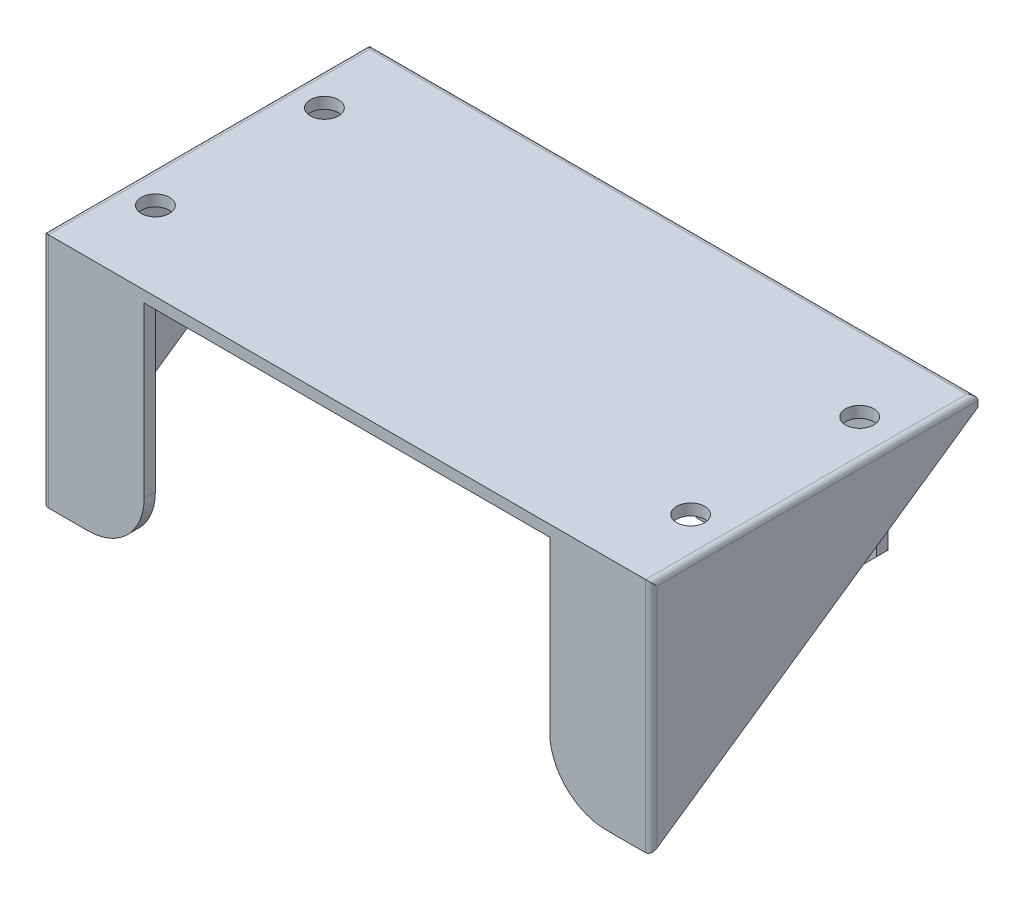
from build123d import *

# Parameters (mm, degrees)
SKETCH_1_W         = 54
SKETCH_1_H         = 29
EXTRUDE_1_DEPTH    = 1
EXTRUDE_2_DEPTH    = 1
EXTRUDE_3_DEPTH    = 1
SKETCH_4_W         = 1
SKETCH_4_H         = 20
EXTRUDE_4_DEPTH    = 8
SKETCH_5_W         = 1
SKETCH_5_H         = 20
EXTRUDE_5_DEPTH    = 8
SKETCH_6_W         = 21
SKETCH_6_H         = 1
EXTRUDE_6_DEPTH    = 20
HOLE_WIZARD_M3_1_D = 2.5
CHAMFER_1_SIZE     = 5
FILLET_1_R         = 0.5
FILLET_2_R         = 5
HOLE_WIZARD_M3_2_D = 2.5


with BuildPart() as part:
    # 草图1 → 凸台-拉伸1 (new body)
    with BuildSketch(Plane(origin=(0, 0, 0), x_dir=(1, 0, 0), z_dir=(0, 1, 0))):
        with Locations((-27, 14.5)):
            Rectangle(SKETCH_1_W, SKETCH_1_H)
    extrude(amount=EXTRUDE_1_DEPTH)

    # 草图2 → 凸台-拉伸2 (add)
    with BuildSketch(Plane.ZY.offset(54)):
        Polygon((-29, 0), (0, 0), (0, -20), align=None)
    extrude(amount=-EXTRUDE_2_DEPTH)

    # 草图3 → 凸台-拉伸3 (add)
    with BuildSketch(Plane(origin=(0, 0, 0), x_dir=(0, 0, -1), z_dir=(1, 0, 0))):
        Polygon((0, 0), (0, -20), (29, 0), align=None)
    extrude(amount=-EXTRUDE_3_DEPTH)

    # 草图4 → 凸台-拉伸4 (add)
    with BuildSketch(Plane.ZY.offset(1)):
        with Locations((-0.5, -10)):
            Rectangle(SKETCH_4_W, SKETCH_4_H)
    extrude(amount=EXTRUDE_4_DEPTH)

    # 草图5 → 凸台-拉伸5 (add)
    with BuildSketch(Plane(origin=(-53, 0, 0), x_dir=(0, 0, -1), z_dir=(1, 0, 0))):
        with Locations((0.5, -10)):
            Rectangle(SKETCH_5_W, SKETCH_5_H)
    extrude(amount=EXTRUDE_5_DEPTH)

    # 草图6 → 凸台-拉伸6 (add)
    with BuildSketch(Plane.XZ):
        with Locations((-18.5, -28.5)):
            Rectangle(SKETCH_6_W, SKETCH_6_H)
    extrude(amount=EXTRUDE_6_DEPTH)

    # M3 螺纹孔1 (through all)
    with Locations(Plane(origin=(0, 0, -29), x_dir=(-1, 0, 0), z_dir=(0, 0, -1))):
        with Locations((18, -10)):
            Hole(HOLE_WIZARD_M3_1_D / 2)

    # 倒角1
    chamfer_1_edges = [part.edges().sort_by_distance(p)[0] for p in [
        (-8, -20, -28.5),
        (-29, -20, -28.5),
    ]]
    chamfer(chamfer_1_edges, length=CHAMFER_1_SIZE)

    # 圆角1
    fillet_1_edges = [part.edges().sort_by_distance(p)[0] for p in [
        (-54, 1, -14.5),
        (0, 1, -14.5),
        (-27, 1, -29),
        (0, -9.5, 0),
        (-54, -9.5, 0),
    ]]
    fillet(fillet_1_edges, radius=FILLET_1_R)

    # 圆角2
    fillet_2_edges = [part.edges().sort_by_distance(p)[0] for p in [
        (-9, -20, -0.5),
        (-45, -20, -0.5),
    ]]
    fillet(fillet_2_edges, radius=FILLET_2_R)

    # M3 螺纹孔2 (through all)
    with Locations(Plane(origin=(0, 1, 0), x_dir=(1, 0, 0), z_dir=(0, 1, 0))):
        with Locations((-51, 22), (-51, 7), (-3.5, 7), (-3.5, 22)):
            Hole(HOLE_WIZARD_M3_2_D / 2)


solid = part.part
